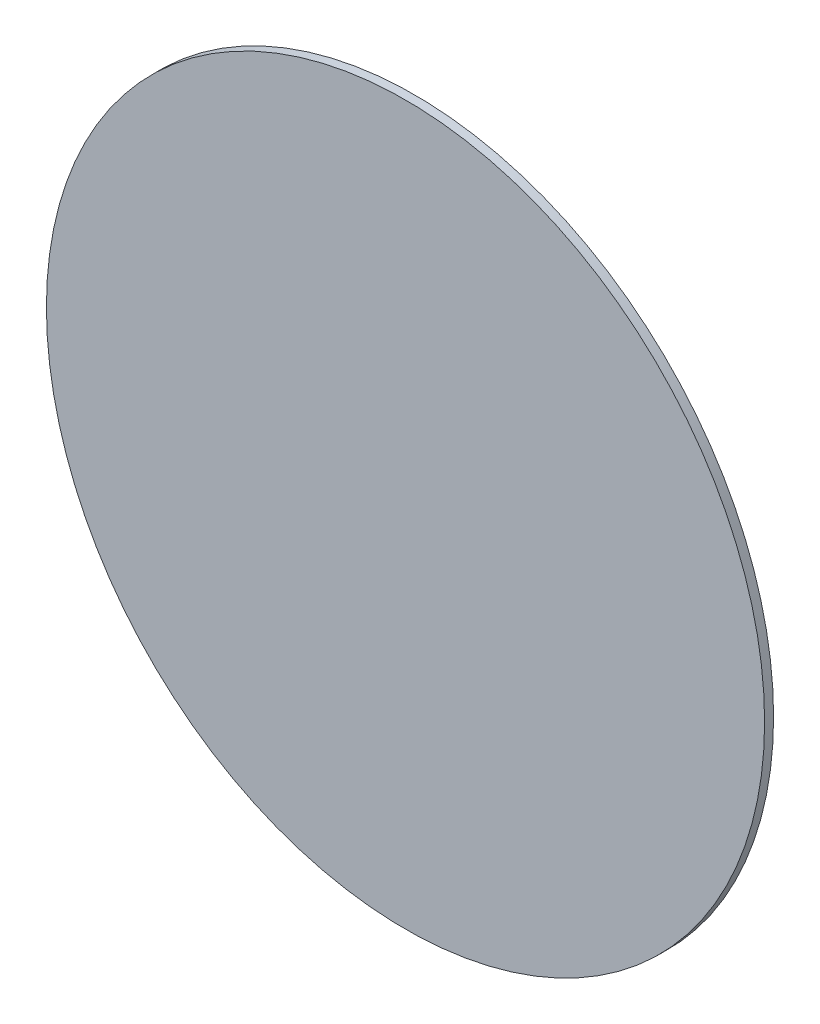
from build123d import *

# Parameters (mm, degrees)
SKETCH1_R      = 20
EXTRUDE1_DEPTH = 0.5


with BuildPart() as part:
    # Sketch1 → Extrude1 (new body)
    with BuildSketch(Plane.XY):
        Circle(SKETCH1_R)
    extrude(amount=EXTRUDE1_DEPTH)


solid = part.part
